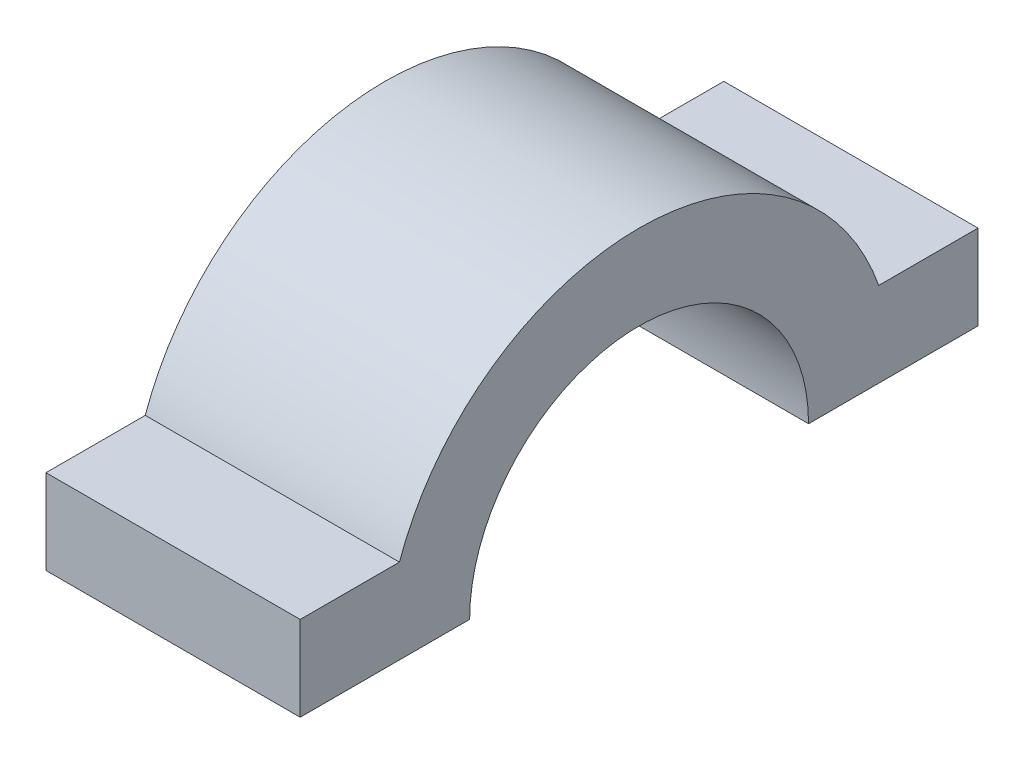
from build123d import *

# Parameters (mm, degrees)
SALIENTE_EXTRUIR1_DEPTH = 15


with BuildPart() as part:
    # Croquis1 → Saliente-Extruir1 (new body)
    with BuildSketch(Plane(origin=(0, 0, 0), x_dir=(0, 0, -1), z_dir=(1, 0, 0))):
        with BuildLine():
            Line((10, 0), (20, 0))
            Line((20, 0), (20, 5))
            Line((20, 5), (14.142135624, 5))
            ThreePointArc((14.142135624, 5), (0, 15), (-14.142135624, 5))
            Line((-14.142135624, 5), (-20, 5))
            Line((-20, 5), (-20, 0))
            Line((-20, 0), (-10, 0))
            ThreePointArc((-10, 0), (0, 10), (10, 0))
        make_face()
    extrude(amount=-SALIENTE_EXTRUIR1_DEPTH)


solid = part.part
